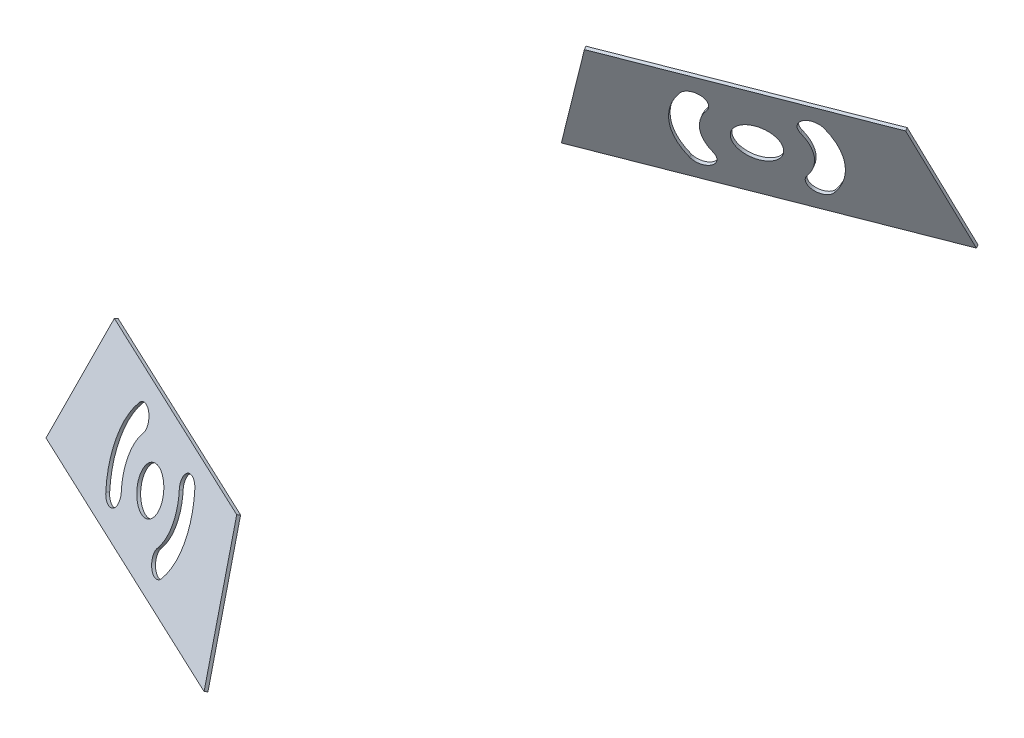
from build123d import *

# Parameters (mm, degrees)
BOSS_EXTRUDE1_START = -12.7
SKETCH2_R           = 13
BOSS_EXTRUDE1_DEPTH = 2
CUT_EXTRUDE1_DEPTH  = 10


with BuildPart() as part:
    # Sketch2 → Boss-Extrude1 (new body)
    with BuildSketch(Plane(origin=(-185.788028835, 158.376979194, -429.22116108), x_dir=(0.9258065436497296, 0.16694116630884537, -0.33913550496340533), z_dir=(0.37624698781411564, -0.3207357424179442, 0.8692334483304326)).offset(BOSS_EXTRUDE1_START)):
        Polygon((113.718253634, 735.792476768), (-39.222903548, 769.633606999), (-73.884194412, 696.376966977), (123.726243288, 652.651911665), align=None)
        with Locations(Location((31.08434974, 713.613740602, 0), (0, 0, 349.848426749))):
            Circle(SKETCH2_R, mode=Mode.SUBTRACT)
    extrude(amount=-BOSS_EXTRUDE1_DEPTH)

    # Sketch3 → Cut-Extrude1 (cut)
    with BuildSketch(Plane(origin=(-191.318859556, 163.091794607, -441.998892771), x_dir=(-0.9258065436497296, -0.16694116630884515, 0.3391355049634055), z_dir=(-0.3762469878141158, 0.3207357424179439, -0.8692334483304328))):
        with BuildLine():
            ThreePointArc((-70.60215835, 730.564929432), (-73.178245929, 704.832857751), (-60.529143361, 682.276795496))
            ThreePointArc((-60.529143361, 682.276795496), (-49.927677304, 682.606821918), (-50.257703726, 693.208287975))
            ThreePointArc((-50.257703726, 693.208287975), (-58.494328654, 707.89595642), (-56.816876277, 724.651724026))
            ThreePointArc((-56.816876277, 724.651724026), (-60.75291461, 734.500967765), (-70.60215835, 730.564929432))
        make_face()
        with BuildLine():
            ThreePointArc((8.433458869, 696.662551773), (11.009546448, 722.394623454), (-1.639556119, 744.950685709))
            ThreePointArc((-1.639556119, 744.950685709), (-12.241022177, 744.620659287), (-11.910995755, 734.01919323))
            ThreePointArc((-11.910995755, 734.01919323), (-3.674370827, 719.331524785), (-5.351823204, 702.575757178))
            ThreePointArc((-5.351823204, 702.575757178), (-1.415784871, 692.726513439), (8.433458869, 696.662551773))
        make_face()
    extrude(amount=-CUT_EXTRUDE1_DEPTH, mode=Mode.SUBTRACT)


with BuildPart() as body_2:
    # Mirror1: mirrored copy
    add(part.part.mirror(Plane.XY))


solid = Compound([part.part, body_2.part])
